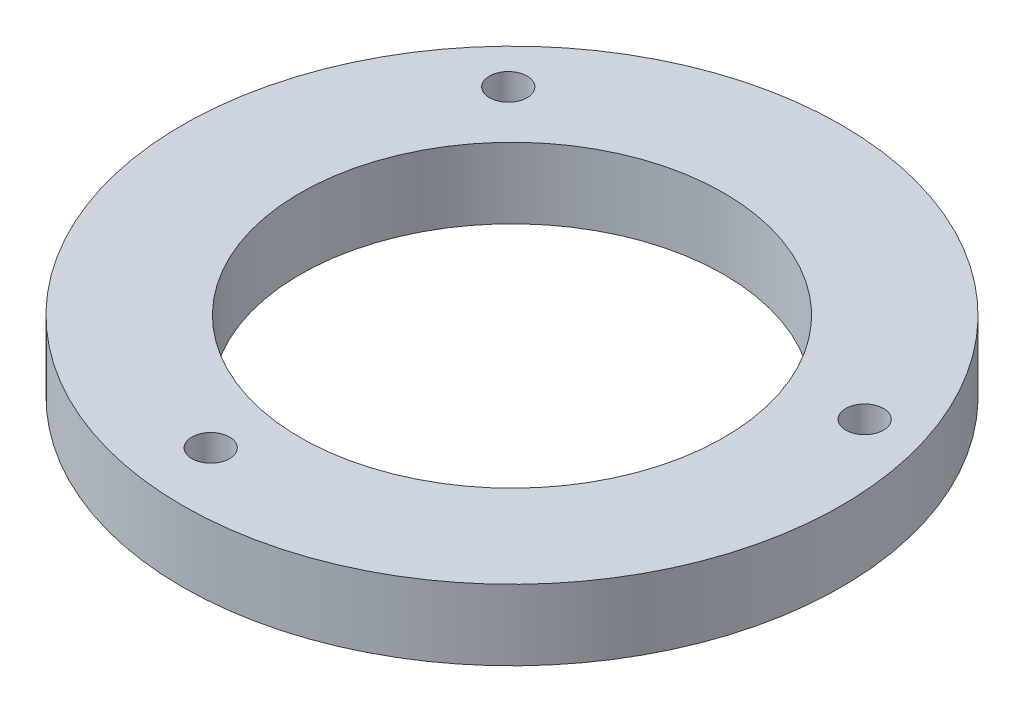
from build123d import *

# Parameters (mm, degrees)
SKETCH1_R           = 35.56
SKETCH1_R_2         = 22.86
BOSS_EXTRUDE1_DEPTH = 7.62
SKETCH2_R           = 2.032
CUT_EXTRUDE1_DEPTH  = 51.863460362


with BuildPart() as part:
    # Sketch1 → Boss-Extrude1 (new body)
    with BuildSketch(Plane(origin=(0, 0, 0), x_dir=(1, 0, 0), z_dir=(0, 1, 0))):
        with Locations(Location((0, 0, 0), (0, 0, 90))):
            Circle(SKETCH1_R)
        with Locations(Location((0, 0, 0), (0, 0, 90))):
            Circle(SKETCH1_R_2, mode=Mode.SUBTRACT)
    extrude(amount=BOSS_EXTRUDE1_DEPTH)

    # Sketch2 → Cut-Extrude1 (cut, through all)
    with BuildSketch(Plane(origin=(0, 7.62, 0), x_dir=(1, 0, 0), z_dir=(0, 1, 0))):
        with Locations(Location((28.751793919, 9.299723395, 0), (0, 0, 270))):
            Circle(SKETCH2_R)
        with Locations(Location((-3.863724802, -28.647995674, 0), (0, 0, 270))):
            Circle(SKETCH2_R)
        with Locations(Location((-21.540206081, 21.136004326, 0), (0, 0, 270))):
            Circle(SKETCH2_R)
    extrude(amount=-CUT_EXTRUDE1_DEPTH, mode=Mode.SUBTRACT)


solid = part.part
